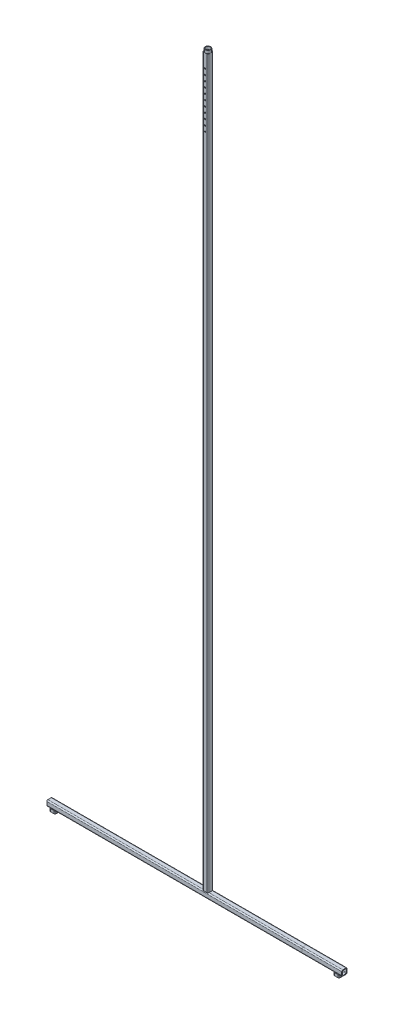
from build123d import *

# Parameters (mm, degrees)
SQUARE_TUBE_20_X_20_X_2_1_DEPTH   = 2660
SQUARE_TUBE_20_X_20_X_2_2_DEPTH   = 146
SQUARE_TUBE_20_X_20_X_2_2_2_DEPTH = 934
SQUARE_TUBE_20_X_20_X_2_4_DEPTH   = 10
SQUARE_TUBE_20_X_20_X_2_4_2_DEPTH = 10
SKETCH14_R                        = 2.5
CUT_EXTRUDE1_DEPTH                = 2188.809610707
LPATTERN1_COUNT                   = 11
LPATTERN1_PITCH                   = 20
SKETCH16_R                        = 10
SKETCH16_R_2                      = 8
BOSS_EXTRUDE1_DEPTH               = 10
SQUARE_TUBE_20_X_20_X_2_13_DEPTH  = 10
SQUARE_TUBE_20_X_20_X_2_14_DEPTH  = 10


with BuildPart() as part:
    # Sketch1 → Square tube 20 X 20 X 2(1) (new body)
    with BuildSketch(Plane(origin=(385.446107784, 689.476047904, 0), x_dir=(1, 0, 0), z_dir=(0, -1, 0))):
        with BuildLine():
            Line((-6, -10), (6, -10))
            ThreePointArc((6, -10), (8.828427125, -8.828427125), (10, -6))
            Line((10, -6), (10, 6))
            ThreePointArc((10, 6), (8.828427125, 8.828427125), (6, 10))
            Line((6, 10), (-6, 10))
            ThreePointArc((-6, 10), (-8.828427125, 8.828427125), (-10, 6))
            Line((-10, 6), (-10, -6))
            ThreePointArc((-10, -6), (-8.828427125, -8.828427125), (-6, -10))
        make_face()
        with BuildLine():
            Line((-6, -8), (6, -8))
            ThreePointArc((6, -8), (7.414213562, -7.414213562), (8, -6))
            Line((8, -6), (8, 6))
            ThreePointArc((8, 6), (7.414213562, 7.414213562), (6, 8))
            Line((6, 8), (-6, 8))
            ThreePointArc((-6, 8), (-7.414213562, 7.414213562), (-8, 6))
            Line((-8, 6), (-8, -6))
            ThreePointArc((-8, -6), (-7.414213562, -7.414213562), (-6, -8))
        make_face(mode=Mode.SUBTRACT)
    extrude(amount=SQUARE_TUBE_20_X_20_X_2_1_DEPTH)

    # Sketch14 → Cut-Extrude1 (cut, symmetric)
    with BuildSketch(Plane(origin=(0, 0, -10), x_dir=(-1, 0, 0), z_dir=(0, 0, -1))):
        with Locations(Location((-384.847064026, 639.476047904, 0), (0, 0, 180))):
            Circle(SKETCH14_R)
    cut_extrude1 = extrude(amount=CUT_EXTRUDE1_DEPTH, both=True, mode=Mode.SUBTRACT)

    # LPattern1: Cut-Extrude1 ×11
    with Locations(*[(0, -i * LPATTERN1_PITCH, 0) for i in range(1, LPATTERN1_COUNT)]):
        add(cut_extrude1, mode=Mode.SUBTRACT)


with BuildPart() as body_2:
    # Sketch11 → Square tube 20 X 20 X 2(2) (new body)
    with BuildSketch(Plane(origin=(739.446107784, -1980.523952096, 0), x_dir=(0, -1, 0), z_dir=(-1, 0, 0))):
        with BuildLine():
            Line((-6, -10), (6, -10))
            ThreePointArc((6, -10), (8.828427125, -8.828427125), (10, -6))
            Line((10, -6), (10, 6))
            ThreePointArc((10, 6), (8.828427125, 8.828427125), (6, 10))
            Line((6, 10), (-6, 10))
            ThreePointArc((-6, 10), (-8.828427125, 8.828427125), (-10, 6))
            Line((-10, 6), (-10, -6))
            ThreePointArc((-10, -6), (-8.828427125, -8.828427125), (-6, -10))
        make_face()
        with BuildLine():
            Line((-6, -8), (6, -8))
            ThreePointArc((6, -8), (7.414213562, -7.414213562), (8, -6))
            Line((8, -6), (8, 6))
            ThreePointArc((8, 6), (7.414213562, 7.414213562), (6, 8))
            Line((6, 8), (-6, 8))
            ThreePointArc((-6, 8), (-7.414213562, 7.414213562), (-8, 6))
            Line((-8, 6), (-8, -6))
            ThreePointArc((-8, -6), (-7.414213562, -7.414213562), (-6, -8))
        make_face(mode=Mode.SUBTRACT)
    extrude(amount=-SQUARE_TUBE_20_X_20_X_2_2_DEPTH)


with BuildPart() as body_3:
    # Sketch11 on segment 2 (carried to segment 2) → Square tube 20 X 20 X 2_2 2 (new body)
    with BuildSketch(Plane(origin=(739.446107784, -1980.523952096, 0), x_dir=(0, -1, 0), z_dir=(-1, 0, 0))):
        with BuildLine():
            Line((-6, -10), (6, -10))
            ThreePointArc((6, -10), (8.828427125, -8.828427125), (10, -6))
            Line((10, -6), (10, 6))
            ThreePointArc((10, 6), (8.828427125, 8.828427125), (6, 10))
            Line((6, 10), (-6, 10))
            ThreePointArc((-6, 10), (-8.828427125, 8.828427125), (-10, 6))
            Line((-10, 6), (-10, -6))
            ThreePointArc((-10, -6), (-8.828427125, -8.828427125), (-6, -10))
        make_face()
        with BuildLine():
            Line((-6, -8), (6, -8))
            ThreePointArc((6, -8), (7.414213562, -7.414213562), (8, -6))
            Line((8, -6), (8, 6))
            ThreePointArc((8, 6), (7.414213562, 7.414213562), (6, 8))
            Line((6, 8), (-6, 8))
            ThreePointArc((-6, 8), (-7.414213562, 7.414213562), (-8, 6))
            Line((-8, 6), (-8, -6))
            ThreePointArc((-8, -6), (-7.414213562, -7.414213562), (-6, -8))
        make_face(mode=Mode.SUBTRACT)
    extrude(amount=SQUARE_TUBE_20_X_20_X_2_2_2_DEPTH)


with BuildPart() as body_4:
    # Sketch13 → Square tube 20 X 20 X 2(4) (new body)
    with BuildSketch(Plane(origin=(-174.553892216, -1990.523952096, 0), x_dir=(1, 0, 0), z_dir=(0, -1, 0))):
        with BuildLine():
            Line((-6, -10), (6, -10))
            ThreePointArc((6, -10), (8.828427125, -8.828427125), (10, -6))
            Line((10, -6), (10, 6))
            ThreePointArc((10, 6), (8.828427125, 8.828427125), (6, 10))
            Line((6, 10), (-6, 10))
            ThreePointArc((-6, 10), (-8.828427125, 8.828427125), (-10, 6))
            Line((-10, 6), (-10, -6))
            ThreePointArc((-10, -6), (-8.828427125, -8.828427125), (-6, -10))
        make_face()
        with BuildLine():
            Line((-6, -8), (6, -8))
            ThreePointArc((6, -8), (7.414213562, -7.414213562), (8, -6))
            Line((8, -6), (8, 6))
            ThreePointArc((8, 6), (7.414213562, 7.414213562), (6, 8))
            Line((6, 8), (-6, 8))
            ThreePointArc((-6, 8), (-7.414213562, 7.414213562), (-8, 6))
            Line((-8, 6), (-8, -6))
            ThreePointArc((-8, -6), (-7.414213562, -7.414213562), (-6, -8))
        make_face(mode=Mode.SUBTRACT)
    extrude(amount=SQUARE_TUBE_20_X_20_X_2_4_DEPTH)


with BuildPart() as body_5:
    # Sketch13 on segment 2 (carried to segment 2) → Square tube 20 X 20 X 2_4 2 (new body)
    with BuildSketch(Plane(origin=(865.446107784, -1990.523952096, 0), x_dir=(1, 0, 0), z_dir=(0, -1, 0))):
        with BuildLine():
            Line((-6, -10), (6, -10))
            ThreePointArc((6, -10), (8.828427125, -8.828427125), (10, -6))
            Line((10, -6), (10, 6))
            ThreePointArc((10, 6), (8.828427125, 8.828427125), (6, 10))
            Line((6, 10), (-6, 10))
            ThreePointArc((-6, 10), (-8.828427125, 8.828427125), (-10, 6))
            Line((-10, 6), (-10, -6))
            ThreePointArc((-10, -6), (-8.828427125, -8.828427125), (-6, -10))
        make_face()
        with BuildLine():
            Line((-6, -8), (6, -8))
            ThreePointArc((6, -8), (7.414213562, -7.414213562), (8, -6))
            Line((8, -6), (8, 6))
            ThreePointArc((8, 6), (7.414213562, 7.414213562), (6, 8))
            Line((6, 8), (-6, 8))
            ThreePointArc((-6, 8), (-7.414213562, 7.414213562), (-8, 6))
            Line((-8, 6), (-8, -6))
            ThreePointArc((-8, -6), (-7.414213562, -7.414213562), (-6, -8))
        make_face(mode=Mode.SUBTRACT)
    extrude(amount=SQUARE_TUBE_20_X_20_X_2_4_2_DEPTH)


with BuildPart() as body_6:
    # Sketch16 → Boss-Extrude1 (new body)
    with BuildSketch(Plane(origin=(0, 689.476047904, 0), x_dir=(1, 0, 0), z_dir=(0, 1, 0))):
        with Locations(Location((385.446107784, 0, 0), (0, 0, 180))):
            Circle(SKETCH16_R)
        with Locations(Location((385.446107784, 0, 0), (0, 0, 180))):
            Circle(SKETCH16_R_2, mode=Mode.SUBTRACT)
    extrude(amount=BOSS_EXTRUDE1_DEPTH)


with BuildPart() as body_7:
    # Sketch19 → Square tube 20 X 20 X 2(13) (new body)
    with BuildSketch(Plane(origin=(-174.553892216, -1990.523952096, 0), x_dir=(1, 0, 0), z_dir=(0, -1, 0))):
        with BuildLine():
            Line((-6, -10), (6, -10))
            ThreePointArc((6, -10), (8.828427125, -8.828427125), (10, -6))
            Line((10, -6), (10, 6))
            ThreePointArc((10, 6), (8.828427125, 8.828427125), (6, 10))
            Line((6, 10), (-6, 10))
            ThreePointArc((-6, 10), (-8.828427125, 8.828427125), (-10, 6))
            Line((-10, 6), (-10, -6))
            ThreePointArc((-10, -6), (-8.828427125, -8.828427125), (-6, -10))
        make_face()
        with BuildLine():
            Line((-6, -8), (6, -8))
            ThreePointArc((6, -8), (7.414213562, -7.414213562), (8, -6))
            Line((8, -6), (8, 6))
            ThreePointArc((8, 6), (7.414213562, 7.414213562), (6, 8))
            Line((6, 8), (-6, 8))
            ThreePointArc((-6, 8), (-7.414213562, 7.414213562), (-8, 6))
            Line((-8, 6), (-8, -6))
            ThreePointArc((-8, -6), (-7.414213562, -7.414213562), (-6, -8))
        make_face(mode=Mode.SUBTRACT)
    extrude(amount=SQUARE_TUBE_20_X_20_X_2_13_DEPTH)


with BuildPart() as body_8:
    # Sketch110 → Square tube 20 X 20 X 2(14) (new body)
    with BuildSketch(Plane(origin=(865.446107784, -1990.523952096, 0), x_dir=(1, 0, 0), z_dir=(0, -1, 0))):
        with BuildLine():
            Line((-6, -10), (6, -10))
            ThreePointArc((6, -10), (8.828427125, -8.828427125), (10, -6))
            Line((10, -6), (10, 6))
            ThreePointArc((10, 6), (8.828427125, 8.828427125), (6, 10))
            Line((6, 10), (-6, 10))
            ThreePointArc((-6, 10), (-8.828427125, 8.828427125), (-10, 6))
            Line((-10, 6), (-10, -6))
            ThreePointArc((-10, -6), (-8.828427125, -8.828427125), (-6, -10))
        make_face()
        with BuildLine():
            Line((-6, -8), (6, -8))
            ThreePointArc((6, -8), (7.414213562, -7.414213562), (8, -6))
            Line((8, -6), (8, 6))
            ThreePointArc((8, 6), (7.414213562, 7.414213562), (6, 8))
            Line((6, 8), (-6, 8))
            ThreePointArc((-6, 8), (-7.414213562, 7.414213562), (-8, 6))
            Line((-8, 6), (-8, -6))
            ThreePointArc((-8, -6), (-7.414213562, -7.414213562), (-6, -8))
        make_face(mode=Mode.SUBTRACT)
    extrude(amount=SQUARE_TUBE_20_X_20_X_2_14_DEPTH)


solid = Compound([part.part, body_2.part, body_3.part, body_4.part, body_5.part, body_6.part, body_7.part, body_8.part])
